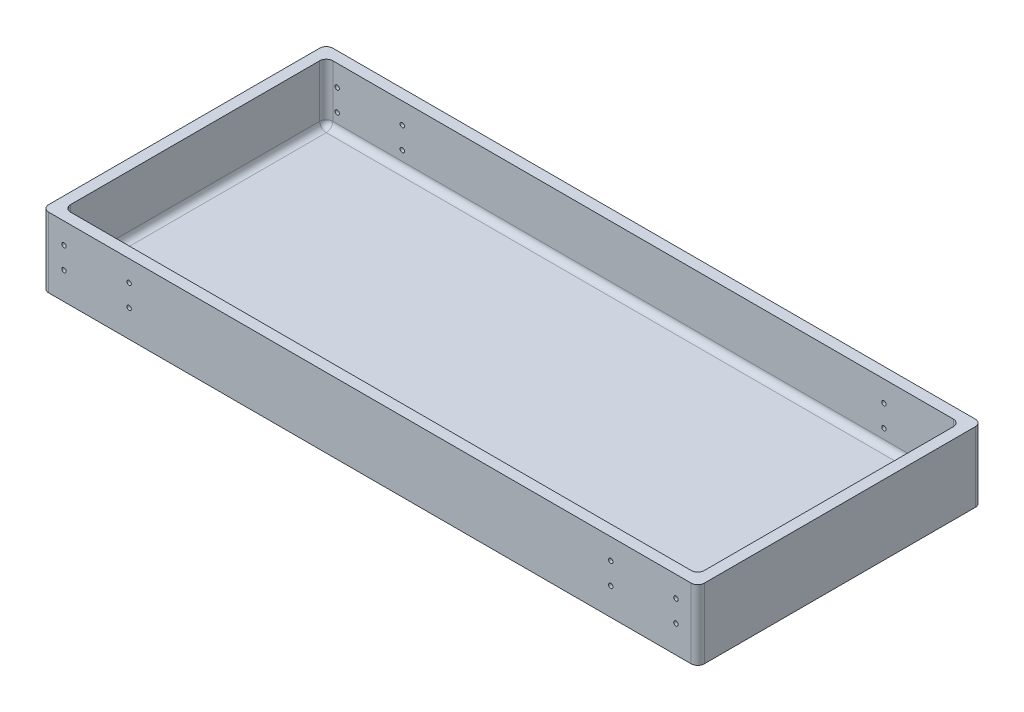
from build123d import *

# Parameters (mm, degrees)
SKETCH1_W           = 300
SKETCH1_H           = 130
BOSS_EXTRUDE1_DEPTH = 32
SHELL1_T            = -5
SKETCH3_R           = 1
CUT_EXTRUDE1_DEPTH  = 202.05720579
FILLET1_R           = 3
FILLET2_R           = 3
FILLET3_R           = 3
FILLET4_R           = 3
FILLET5_R           = 3
FILLET6_R           = 3
FILLET7_R           = 3
FILLET8_R           = 3


with BuildPart() as part:
    # Sketch1 → Boss-Extrude1 (new body)
    with BuildSketch(Plane(origin=(0, 0, 0), x_dir=(1, 0, 0), z_dir=(0, 1, 0))):
        Rectangle(SKETCH1_W, SKETCH1_H)
    extrude(amount=BOSS_EXTRUDE1_DEPTH)

    # Shell1
    shell1_openings = [part.faces().sort_by_distance(p)[0] for p in [
        (0, 32, 0),
    ]]
    offset(amount=SHELL1_T, openings=shell1_openings, kind=Kind.INTERSECTION)

    # Sketch3 → Cut-Extrude1 (cut, through all)
    with BuildSketch(Plane.XY.offset(65)):
        with Locations((-140, 22.4)):
            Circle(SKETCH3_R)
        with Locations((-110.2, 22.4)):
            Circle(SKETCH3_R)
        with Locations((-140, 12.5)):
            Circle(SKETCH3_R)
        with Locations((-110.2, 12.5)):
            Circle(SKETCH3_R)
    cut_extrude1 = extrude(amount=-CUT_EXTRUDE1_DEPTH, mode=Mode.SUBTRACT)

    # Mirror1: Cut-Extrude1 across plane
    add(cut_extrude1.mirror(Plane(origin=(0, 0, 0), x_dir=(0, 0, 1), z_dir=(1, 0, 0))), mode=Mode.SUBTRACT)

    # Fillet1
    fillet1_edges = [part.edges().sort_by_distance(p)[0] for p in [
        (145, 5, 0),
    ]]
    fillet(fillet1_edges, radius=FILLET1_R)

    # Fillet2
    fillet2_edges = [part.edges().sort_by_distance(p)[0] for p in [
        (145, 20, -60),
        (-1.5, 5, -60),
        (144.121320344, 5.878679656, -60),
    ]]
    fillet(fillet2_edges, radius=FILLET2_R)

    # Fillet3
    fillet3_edges = [part.edges().sort_by_distance(p)[0] for p in [
        (-145, 20, -60),
        (-145, 5, 1.5),
        (-145, 5.878679656, -59.121320344),
    ]]
    fillet(fillet3_edges, radius=FILLET3_R)

    # Fillet4
    fillet4_edges = [part.edges().sort_by_distance(p)[0] for p in [
        (0, 5, 60),
        (-144.121320344, 5.878679656, 60),
        (145, 20, 60),
        (-145, 20, 60),
        (144.121320344, 5.878679656, 60),
    ]]
    fillet(fillet4_edges, radius=FILLET4_R)

    # Fillet5
    fillet5_edges = [part.edges().sort_by_distance(p)[0] for p in [
        (150, 16, -65),
    ]]
    fillet(fillet5_edges, radius=FILLET5_R)

    # Fillet6
    fillet6_edges = [part.edges().sort_by_distance(p)[0] for p in [
        (-150, 16, -65),
    ]]
    fillet(fillet6_edges, radius=FILLET6_R)

    # Fillet7
    fillet7_edges = [part.edges().sort_by_distance(p)[0] for p in [
        (-150, 16, 65),
    ]]
    fillet(fillet7_edges, radius=FILLET7_R)

    # Fillet8
    fillet8_edges = [part.edges().sort_by_distance(p)[0] for p in [
        (150, 16, 65),
    ]]
    fillet(fillet8_edges, radius=FILLET8_R)


solid = part.part
